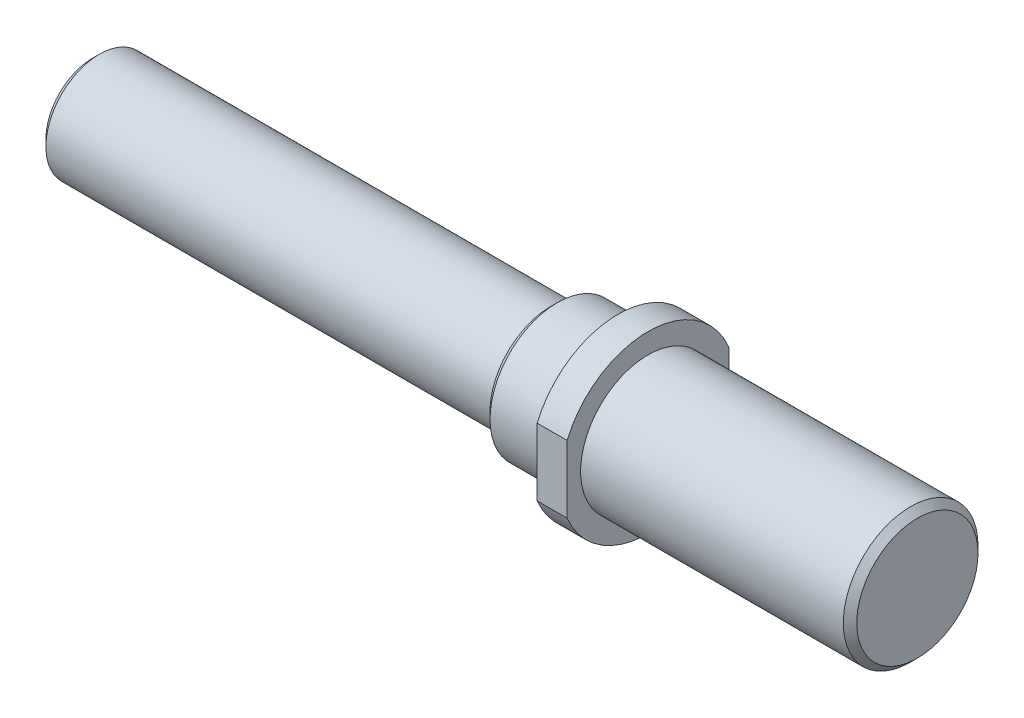
from build123d import *

# Parameters (mm, degrees)
BOSS_EXTRUDE1_DEPTH      = 20
BOSS_EXTRUDE1_DEPTH_BACK = 41.225
SKETCH1_R                = 7
CUT_EXTRUDE1_START       = -7.225
SKETCH2_R                = 7
SKETCH2_R_2              = 3.96875
CUT_EXTRUDE1_DEPTH       = 36.171941222
SKETCH3_R                = 7
SKETCH3_R_2              = 5
CUT_EXTRUDE2_DEPTH       = 5
SKETCH4_R                = 7
SKETCH4_R_2              = 6.5
CUT_EXTRUDE3_DEPTH       = 41.236799077
CUT_EXTRUDE4_START       = -20
SKETCH5_R                = 6.5
SKETCH5_R_2              = 5
CUT_EXTRUDE4_DEPTH       = 20
CHAMFER1_SIZE            = 0.5
CUT_EXTRUDE5_DEPTH       = 43.237431563


with BuildPart() as part:
    # Sketch1 → Boss-Extrude1 (new, two sides: drawn at the far end of the back side and taken through both)
    with BuildSketch(Plane(origin=(0, 0, 0), x_dir=(0, 0, -1), z_dir=(1, 0, 0)).offset(-BOSS_EXTRUDE1_DEPTH_BACK)):
        Circle(SKETCH1_R)
    extrude(amount=BOSS_EXTRUDE1_DEPTH + BOSS_EXTRUDE1_DEPTH_BACK)

    # Sketch2 → Cut-Extrude1 (cut, through all)
    with BuildSketch(Plane(origin=(0, 0, 0), x_dir=(0, 0, -1), z_dir=(1, 0, 0)).offset(CUT_EXTRUDE1_START)):
        Circle(SKETCH2_R)
        Circle(SKETCH2_R_2, mode=Mode.SUBTRACT)
    extrude(amount=-CUT_EXTRUDE1_DEPTH, mode=Mode.SUBTRACT)

    # Sketch3 → Cut-Extrude2 (cut)
    with BuildSketch(Plane.ZY.offset(7.225)):
        Circle(SKETCH3_R)
        Circle(SKETCH3_R_2, mode=Mode.SUBTRACT)
    extrude(amount=-CUT_EXTRUDE2_DEPTH, mode=Mode.SUBTRACT)

    # Sketch4 → Cut-Extrude3 (cut, through all)
    with BuildSketch(Plane.ZY.offset(2.225)):
        Circle(SKETCH4_R)
        Circle(SKETCH4_R_2, mode=Mode.SUBTRACT)
    extrude(amount=-CUT_EXTRUDE3_DEPTH, mode=Mode.SUBTRACT)

    # Sketch5 → Cut-Extrude4 (cut)
    with BuildSketch(Plane(origin=(20, 0, 0), x_dir=(0, 0, -1), z_dir=(1, 0, 0)).offset(CUT_EXTRUDE4_START)):
        with Locations(Location((0, 0, 0), (0, 0, 180))):
            Circle(SKETCH5_R)
        with Locations(Location((0, 0, 0), (0, 0, 180))):
            Circle(SKETCH5_R_2, mode=Mode.SUBTRACT)
    extrude(amount=CUT_EXTRUDE4_DEPTH, mode=Mode.SUBTRACT)

    # Chamfer1
    chamfer1_edges = [part.edges().sort_by_distance(p)[0] for p in [
        (-7.225, 0, -5),
        (20, 0, -5),
        (-41.225, 0, 3.96875),
    ]]
    chamfer(chamfer1_edges, length=CHAMFER1_SIZE)

    # Sketch6 → Cut-Extrude5 (cut, through all)
    with BuildSketch(Plane(origin=(0, 0, 0), x_dir=(0, 0, -1), z_dir=(1, 0, 0))):
        with BuildLine():
            Line((-6, -2.5), (-6, 2.5))
            ThreePointArc((-6, 2.5), (-6.5, 0), (-6, -2.5))
        make_face()
        with BuildLine():
            Line((6, 2.5), (6, -2.5))
            ThreePointArc((6, -2.5), (6.5, 0), (6, 2.5))
        make_face()
    extrude(amount=-CUT_EXTRUDE5_DEPTH, mode=Mode.SUBTRACT)


solid = part.part
